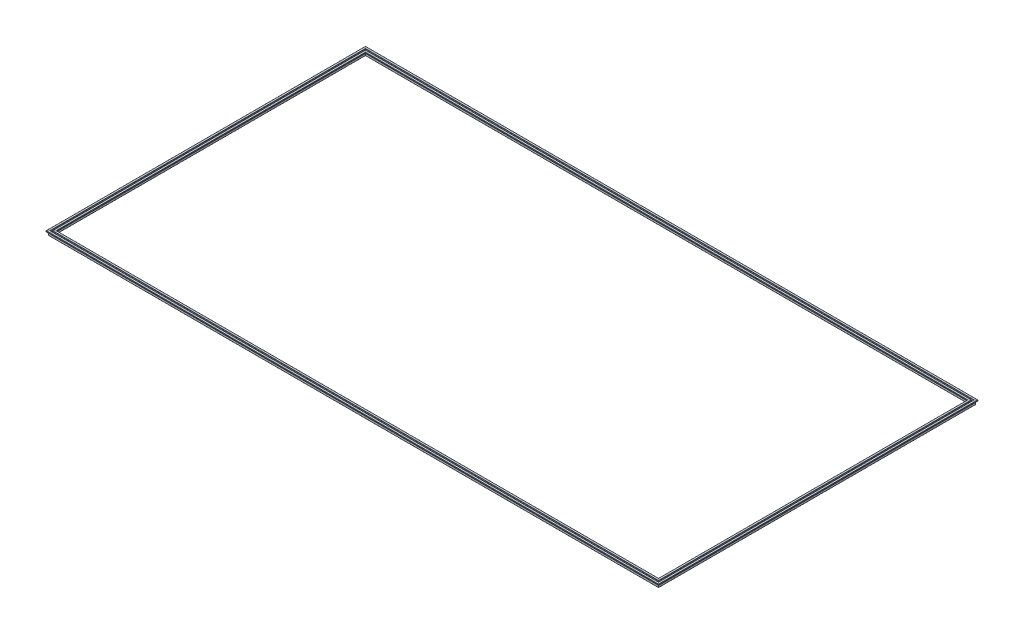
from build123d import *


with BuildPart() as part:
    # Sweep1: sweep along a path in Sketch1
    with BuildLine(Plane(origin=(0, 0, 0), x_dir=(1, 0, 0), z_dir=(0, 1, 0))) as sweep1_path:
        Line((0, 0), (288, 0))
        Line((288, 0), (288, -149))
        Line((288, -149), (0, -149))
        Line((0, -149), (0, 0))
    # Sketch2 → Sweep1 (sweep)
    with BuildSketch(Plane(origin=(144, 0, 0), x_dir=(0, 0, -1), z_dir=(1, 0, 0))):
        with BuildLine():
            Line((-147.85, 2), (-148.65, 2))
            ThreePointArc((-148.65, 2), (-148.720710678, 1.970710678), (-148.75, 1.9))
            Line((-148.75, 1.9), (-148.75, 0.6))
            ThreePointArc((-148.75, 0.6), (-148.779289322, 0.529289322), (-148.85, 0.5))
            Line((-148.85, 0.5), (-149.15, 0.5))
            ThreePointArc((-149.15, 0.5), (-149.220710678, 0.529289322), (-149.25, 0.6))
            Line((-149.25, 0.6), (-149.25, 1.9))
            ThreePointArc((-149.25, 1.9), (-149.279289322, 1.970710678), (-149.35, 2))
            Line((-149.35, 2), (-150.15, 2))
            ThreePointArc((-150.15, 2), (-150.220710678, 1.970710678), (-150.25, 1.9))
            Line((-150.25, 1.9), (-150.25, 1.6))
            ThreePointArc((-150.25, 1.6), (-150.220710678, 1.529289322), (-150.15, 1.5))
            Line((-150.15, 1.5), (-149.75, 1.5))
            ThreePointArc((-149.75, 1.5), (-149.679289322, 1.470710678), (-149.65, 1.4))
            Line((-149.65, 1.4), (-149.65, 0.1))
            ThreePointArc((-149.65, 0.1), (-149.620710678, 0.029289322), (-149.55, 0))
            Line((-149.55, 0), (-148.45, 0))
            ThreePointArc((-148.45, 0), (-148.379289322, 0.029289322), (-148.35, 0.1))
            Line((-148.35, 0.1), (-148.35, 1.4))
            ThreePointArc((-148.35, 1.4), (-148.320710678, 1.470710678), (-148.25, 1.5))
            Line((-148.25, 1.5), (-147.85, 1.5))
            ThreePointArc((-147.85, 1.5), (-147.779289322, 1.529289322), (-147.75, 1.6))
            Line((-147.75, 1.6), (-147.75, 1.9))
            ThreePointArc((-147.75, 1.9), (-147.779289322, 1.970710678), (-147.85, 2))
        make_face()
    sweep(path=sweep1_path.line, transition=Transition.RIGHT)


solid = part.part
